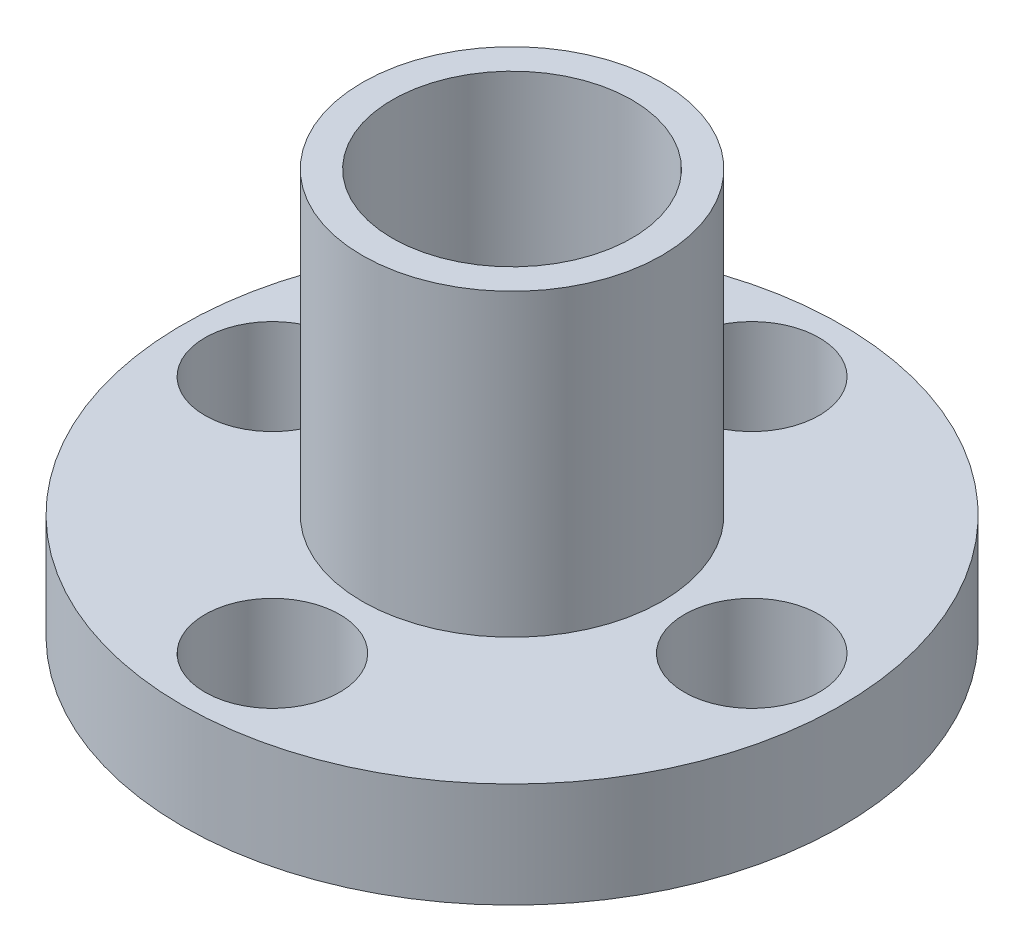
from build123d import *

# Parameters (mm, degrees)
SKETCH1_R           = 11
SKETCH1_R_2         = 2.25
SKETCH1_R_3         = 4
BOSS_EXTRUDE1_DEPTH = 3.5
SKETCH2_R           = 5
SKETCH2_R_2         = 4
BOSS_EXTRUDE2_DEPTH = 10
BOSS_EXTRUDE3_START = 1.5
SKETCH3_R           = 5
SKETCH3_R_2         = 4
BOSS_EXTRUDE3_DEPTH = 1.5


with BuildPart() as part:
    # Sketch1 → Boss-Extrude1 (new body)
    with BuildSketch(Plane(origin=(0, 0, 0), x_dir=(1, 0, 0), z_dir=(0, 1, 0))):
        with Locations(Location((0, 0, 0), (0, 0, 270))):
            Circle(SKETCH1_R)
        with Locations(Location((0, 8, 0), (0, 0, 270))):
            Circle(SKETCH1_R_2, mode=Mode.SUBTRACT)
        with Locations(Location((8, 0, 0), (0, 0, 270))):
            Circle(SKETCH1_R_2, mode=Mode.SUBTRACT)
        with Locations(Location((0, -8, 0), (0, 0, 270))):
            Circle(SKETCH1_R_2, mode=Mode.SUBTRACT)
        with Locations(Location((-8, 0, 0), (0, 0, 270))):
            Circle(SKETCH1_R_2, mode=Mode.SUBTRACT)
        with Locations(Location((0, 0, 0), (0, 0, 270))):
            Circle(SKETCH1_R_3, mode=Mode.SUBTRACT)
    extrude(amount=BOSS_EXTRUDE1_DEPTH)

    # Sketch2 → Boss-Extrude2 (add)
    with BuildSketch(Plane(origin=(0, 3.5, 0), x_dir=(1, 0, 0), z_dir=(0, 1, 0))):
        with Locations(Location((0, 0, 0), (0, 0, 270))):
            Circle(SKETCH2_R)
        with Locations(Location((0, 0, 0), (0, 0, 270))):
            Circle(SKETCH2_R_2, mode=Mode.SUBTRACT)
    extrude(amount=BOSS_EXTRUDE2_DEPTH)

    # Sketch3 → Boss-Extrude3 (add)
    with BuildSketch(Plane.XZ.offset(BOSS_EXTRUDE3_START)):
        with Locations(Location((0, 0, 0), (0, 0, 90))):
            Circle(SKETCH3_R)
        with Locations(Location((0, 0, 0), (0, 0, 270))):
            Circle(SKETCH3_R_2, mode=Mode.SUBTRACT)
    extrude(amount=-BOSS_EXTRUDE3_DEPTH)


solid = part.part
